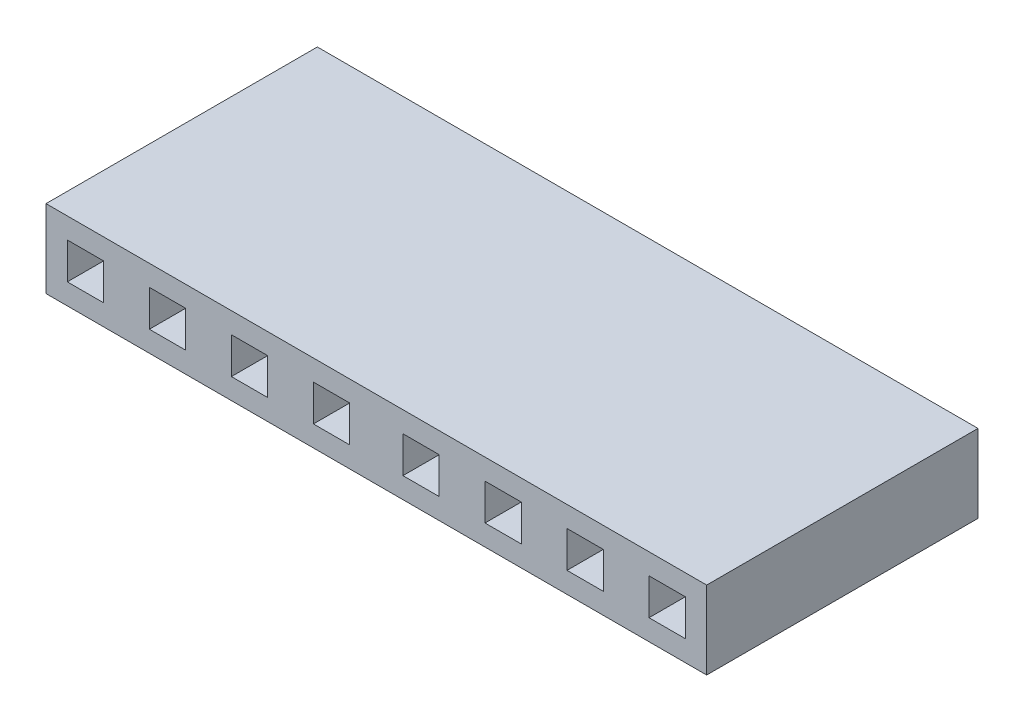
from build123d import *

# Parameters (mm, degrees)
CROQUIS1_W              = 20.94
CROQUIS1_H              = 2.47
SALIENTE_EXTRUIR1_DEPTH = 8.6
CROQUIS2_W              = 1.15
CROQUIS2_H              = 1.15
CORTAR_EXTRUIR1_DEPTH   = 6.45


with BuildPart() as part:
    # Croquis1 → Saliente-Extruir1 (new body)
    with BuildSketch(Plane.XY):
        with Locations((-10.47, 1.235)):
            Rectangle(CROQUIS1_W, CROQUIS1_H)
    extrude(amount=SALIENTE_EXTRUIR1_DEPTH)

    # Croquis2 → Cortar-Extruir1 (cut)
    with BuildSketch(Plane.XY.offset(8.6)):
        with Locations((-14.488886926, 1.235)):
            Rectangle(CROQUIS2_W, CROQUIS2_H)
        with Locations((-11.888886926, 1.235)):
            Rectangle(CROQUIS2_W, CROQUIS2_H)
        with Locations((-17.088886926, 1.235)):
            Rectangle(CROQUIS2_W, CROQUIS2_H)
        with Locations((-19.688886926, 1.235)):
            Rectangle(CROQUIS2_W, CROQUIS2_H)
        with Locations((-1.251113074, 1.235)):
            Rectangle(CROQUIS2_W, CROQUIS2_H)
        with Locations((-3.851113074, 1.235)):
            Rectangle(CROQUIS2_W, CROQUIS2_H)
        with Locations((-6.451113074, 1.235)):
            Rectangle(CROQUIS2_W, CROQUIS2_H)
        with Locations((-9.051113074, 1.235)):
            Rectangle(CROQUIS2_W, CROQUIS2_H)
    extrude(amount=-CORTAR_EXTRUIR1_DEPTH, mode=Mode.SUBTRACT)


solid = part.part
